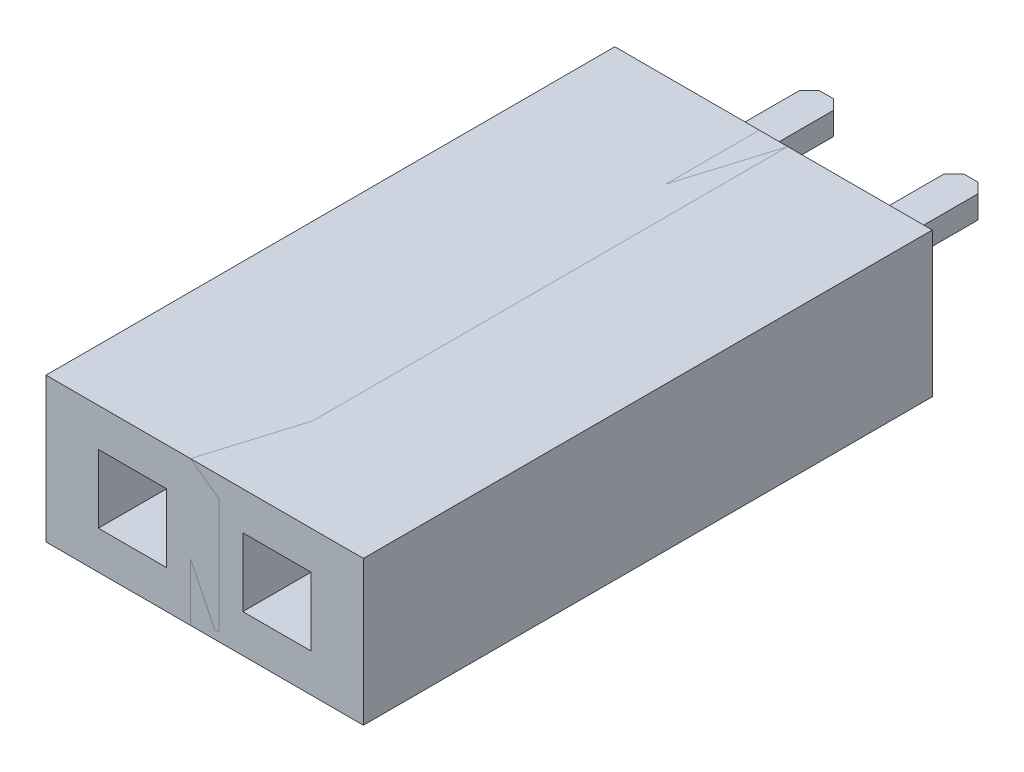
from build123d import *

# Parameters (mm, degrees)
SKETCH1_W           = 2.54
SKETCH1_H           = 10
BOSS_EXTRUDE1_DEPTH = 1.52
SKETCH2_W           = 1.2
SKETCH2_H           = 1.2
CUT_EXTRUDE1_DEPTH  = 7
BOSS_EXTRUDE2_DEPTH = 0.2
LPATTERN1_COUNT     = 2
LPATTERN1_PITCH     = 2.54


with BuildPart() as part:
    # Sketch1 → Boss-Extrude1 (new, symmetric)
    with BuildSketch(Plane(origin=(0, 0, 0), x_dir=(0, -1, 0), z_dir=(1, 0, 0))):
        with Locations((0, -5)):
            Rectangle(SKETCH1_W, SKETCH1_H)
    extrude(amount=BOSS_EXTRUDE1_DEPTH, both=True)

    # Sketch2 → Cut-Extrude1 (cut)
    with BuildSketch(Plane(origin=(0, 0, 10), x_dir=(-1, 0, 0), z_dir=(0, 0, 1))):
        Rectangle(SKETCH2_W, SKETCH2_H)
    extrude(amount=-CUT_EXTRUDE1_DEPTH, mode=Mode.SUBTRACT)

    # Sketch3 → Boss-Extrude2 (add, symmetric)
    with BuildSketch(Plane(origin=(0, 0, 0), x_dir=(1, 0, 0), z_dir=(0, 1, 0))):
        Polygon((-0.3, 0), (-0.3, 2.024264069), (-0.124264069, 2.2), (0.124264069, 2.2), (0.3, 2.024264069), (0.3, 0), align=None)
    extrude(amount=BOSS_EXTRUDE2_DEPTH, both=True)


with BuildPart() as lpattern1_1:
    # LPattern1: pattern copy
    add(part.part.moved(Location(Vector(1, 0, 0) * (1 * LPATTERN1_PITCH))))


solid = Compound([part.part, lpattern1_1.part])
